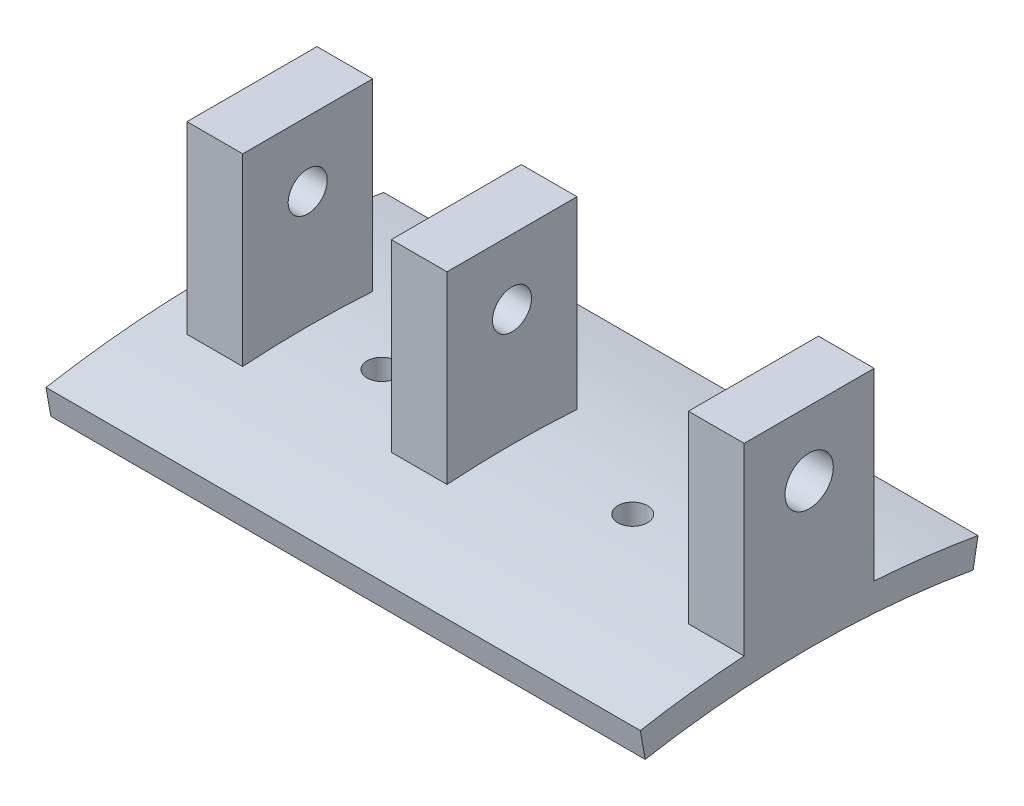
from build123d import *

# Parameters (mm, degrees)
BASE_SKETCH_W           = 64
BASE_SKETCH_H           = 3
BASE_ANGLE              = 20
UPPER_EAR_SKETCH_W      = 6
UPPER_EAR_SKETCH_H      = 20.8
UPPER_EAR_DEPTH         = 7
LOWER_EAR_SKETCH_W      = 6
LOWER_EAR_SKETCH_H      = 20.8
LOWER_EAR_DEPTH         = 7
STOP_SKETCH_W           = 6
STOP_SKETCH_H           = 20.8
STOP_DEPTH              = 7
UPPER_EAR_HOLE_SKETCH_R = 2.1
UPPER_EAR_HOLE_DEPTH    = 6
LOWER_EAR_HOLE_SKETCH_R = 2.1
LOWER_EAR_HOLE_DEPTH    = 6
STOP_HOLE_SKETCH_R      = 2.6
STOP_HOLE_DEPTH         = 6
SCREW_HOLE_0_SKETCH_R   = 1.6
SCREW_HOLE_0_DEPTH      = 200
SCREW_HOLE_1_SKETCH_R   = 1.6
SCREW_HOLE_1_DEPTH      = 200


with BuildPart() as part:
    # Base Sketch → Base (revolve, symmetric)
    with BuildSketch(Plane.XY) as base_sk:
        with Locations((-598, 103.2)):
            Rectangle(BASE_SKETCH_W, BASE_SKETCH_H)
    revolve(axis=Axis((-3000, 0, 0), (1, 0, 0)), revolution_arc=BASE_ANGLE / 2)
    revolve(base_sk.sketch, axis=Axis((-3000, 0, 0), (-1, 0, 0)), revolution_arc=BASE_ANGLE / 2)

    # Upper Ear Sketch → Upper Ear (add, symmetric)
    with BuildSketch(Plane.XY):
        with Locations((-623, 113.9)):
            Rectangle(UPPER_EAR_SKETCH_W, UPPER_EAR_SKETCH_H)
    extrude(amount=UPPER_EAR_DEPTH, both=True)

    # Lower Ear Sketch → Lower Ear (add, symmetric)
    with BuildSketch(Plane.XY):
        with Locations((-601, 113.9)):
            Rectangle(LOWER_EAR_SKETCH_W, LOWER_EAR_SKETCH_H)
    extrude(amount=LOWER_EAR_DEPTH, both=True)

    # Stop Sketch → Stop (add, symmetric)
    with BuildSketch(Plane.XY):
        with Locations((-569, 113.9)):
            Rectangle(STOP_SKETCH_W, STOP_SKETCH_H)
    extrude(amount=STOP_DEPTH, both=True)

    # Upper Ear Hole Sketch → Upper Ear Hole (cut)
    with BuildSketch(Plane(origin=(-626, 0, 0), x_dir=(0, 0, -1), z_dir=(1, 0, 0))):
        with Locations((0, 117.3)):
            Circle(UPPER_EAR_HOLE_SKETCH_R)
    extrude(amount=UPPER_EAR_HOLE_DEPTH, mode=Mode.SUBTRACT)

    # Lower Ear Hole Sketch → Lower Ear Hole (cut)
    with BuildSketch(Plane(origin=(-604, 0, 0), x_dir=(0, 0, -1), z_dir=(1, 0, 0))):
        with Locations((0, 117.3)):
            Circle(LOWER_EAR_HOLE_SKETCH_R)
    extrude(amount=LOWER_EAR_HOLE_DEPTH, mode=Mode.SUBTRACT)

    # Stop Hole Sketch → Stop Hole (cut)
    with BuildSketch(Plane(origin=(-572, 0, 0), x_dir=(0, 0, -1), z_dir=(1, 0, 0))):
        with Locations((0, 117.3)):
            Circle(STOP_HOLE_SKETCH_R)
    extrude(amount=STOP_HOLE_DEPTH, mode=Mode.SUBTRACT)

    # Screw Hole 0 Sketch → Screw Hole 0 (cut)
    with BuildSketch(Plane(origin=(0, 0, 0), x_dir=(-1, 0, 0), z_dir=(0, 1, 0))):
        with Locations((585, 0)):
            Circle(SCREW_HOLE_0_SKETCH_R)
    extrude(amount=SCREW_HOLE_0_DEPTH, mode=Mode.SUBTRACT)

    # Screw Hole 1 Sketch → Screw Hole 1 (cut)
    with BuildSketch(Plane(origin=(0, 0, 0), x_dir=(-1, 0, 0), z_dir=(0, 1, 0))):
        with Locations((612, 0)):
            Circle(SCREW_HOLE_1_SKETCH_R)
    extrude(amount=SCREW_HOLE_1_DEPTH, mode=Mode.SUBTRACT)


solid = part.part
